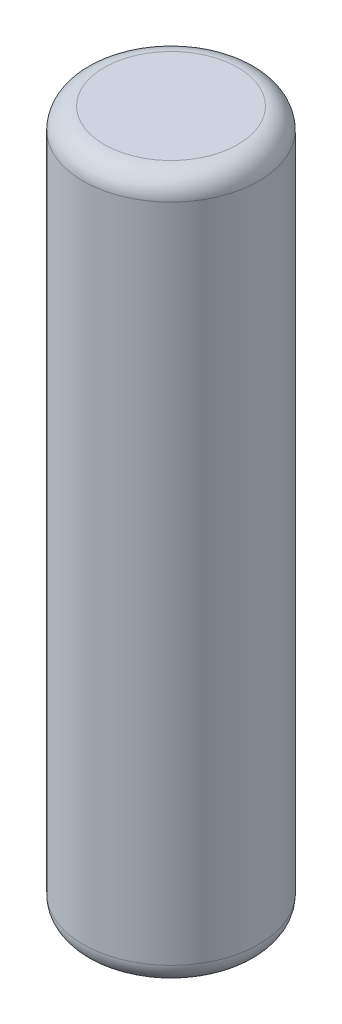
from build123d import *

# Parameters (mm, degrees)
SKETCH1_R           = 1.25
BOSS_EXTRUDE1_DEPTH = 10
FILLET1_R           = 0.3


with BuildPart() as part:
    # Sketch1 → Boss-Extrude1 (new body)
    with BuildSketch(Plane(origin=(0, 0, 0), x_dir=(1, 0, 0), z_dir=(0, 1, 0))):
        with Locations(Location((0, 0, 0), (0, 0, 270))):
            Circle(SKETCH1_R)
    extrude(amount=BOSS_EXTRUDE1_DEPTH)

    # Fillet1
    fillet1_edges = [part.edges().sort_by_distance(p)[0] for p in [
        (0, 0, -1.25),
        (0, 10, -1.25),
    ]]
    fillet(fillet1_edges, radius=FILLET1_R)


solid = part.part
